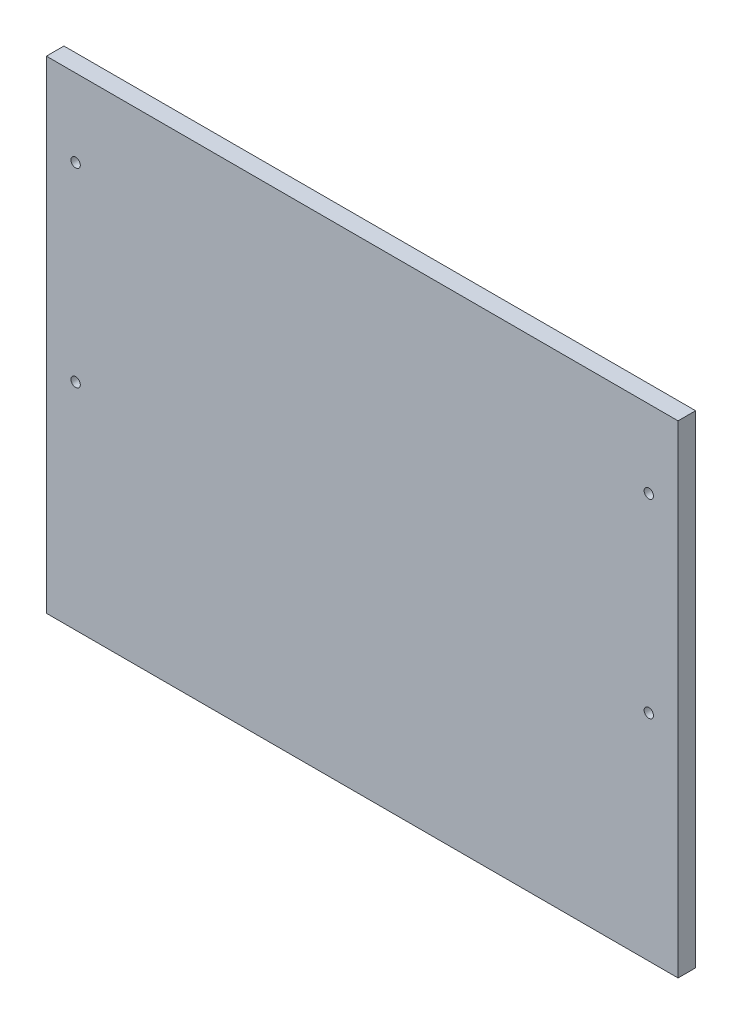
from build123d import *

# Parameters (mm, degrees)
SKETCH_1_W      = 432
SKETCH_1_H      = 330
SKETCH_1_R      = 3.2
EXTRUDE_1_DEPTH = 12


with BuildPart() as part:
    # 草图1 → 凸台-拉伸1 (new body)
    with BuildSketch(Plane.XY):
        with Locations((216, -70)):
            Rectangle(SKETCH_1_W, SKETCH_1_H)
        with Locations((20, 42)):
            Circle(SKETCH_1_R, mode=Mode.SUBTRACT)
        with Locations((412, 42)):
            Circle(SKETCH_1_R, mode=Mode.SUBTRACT)
        with Locations((20, -88)):
            Circle(SKETCH_1_R, mode=Mode.SUBTRACT)
        with Locations((412, -88)):
            Circle(SKETCH_1_R, mode=Mode.SUBTRACT)
    extrude(amount=EXTRUDE_1_DEPTH)


solid = part.part
